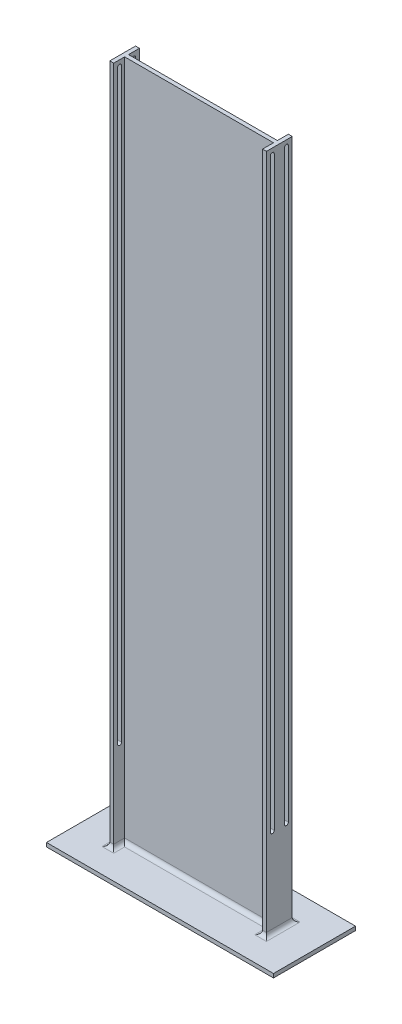
from build123d import *

# Parameters (mm, degrees)
WALL_EXTRUDE_DEPTH           = 190.5
RIGHT_GUIDE_EXTRUDE_DEPTH    = 10
SKETCH3_W                    = 581
SKETCH3_H                    = 210
BOTTOM_FOOT_COMPLETION_DEPTH = 10
SKETCH4_W                    = 381
SKETCH4_H                    = 10
PLATFORM_STOPPER_DEPTH       = 28
STRUCTURAL_FILLETS_R         = 10


with BuildPart() as part:
    # Sketch1 → Wall extrude (new, symmetric)
    with BuildSketch(Plane(origin=(0, 0, 0), x_dir=(0, 0, -1), z_dir=(1, 0, 0))):
        Polygon((0, 0), (-100, 0), (-100, -10), (10, -10), (110, -10), (110, 0), (10, 0), (10, 1741.5), (0, 1741.5), align=None)
    extrude(amount=WALL_EXTRUDE_DEPTH, both=True)

    # Sketch2 → Right guide extrude (add)
    with BuildSketch(Plane(origin=(190.5, 0, 0), x_dir=(0, 0, -1), z_dir=(1, 0, 0))):
        Polygon((0, 1741.5), (38, 1741.5), (38, -10), (0, -10), (-28, -10), (-28, 1741.5), align=None)
        with BuildLine():
            Line((18, 226.5), (18, 1726.5))
            ThreePointArc((18, 1726.5), (23, 1731.5), (28, 1726.5))
            Line((28, 1726.5), (28, 226.5))
            ThreePointArc((28, 226.5), (23, 221.5), (18, 226.5))
        make_face(mode=Mode.SUBTRACT)
        with BuildLine():
            Line((-18, 1726.5), (-18, 226.5))
            ThreePointArc((-18, 226.5), (-13, 221.5), (-8, 226.5))
            Line((-8, 226.5), (-8, 1726.5))
            ThreePointArc((-8, 1726.5), (-13, 1731.5), (-18, 1726.5))
        make_face(mode=Mode.SUBTRACT)
    right_guide_extrude = extrude(amount=RIGHT_GUIDE_EXTRUDE_DEPTH)

    # Left guide extrude: Right guide extrude across plane
    add(right_guide_extrude.mirror(Plane(origin=(0, 0, 0), x_dir=(0, 0, 1), z_dir=(1, 0, 0))))

    # Sketch3 → Bottom foot completion (add)
    with BuildSketch(Plane.XZ.offset(10)):
        with Locations((0, -5)):
            Rectangle(SKETCH3_W, SKETCH3_H)
    extrude(amount=-BOTTOM_FOOT_COMPLETION_DEPTH)

    # Sketch4 → Platform stopper (add)
    with BuildSketch(Plane(origin=(0, 0, -10), x_dir=(-1, 0, 0), z_dir=(0, 0, -1))):
        with Locations((0, 131.5)):
            Rectangle(SKETCH4_W, SKETCH4_H)
    extrude(amount=PLATFORM_STOPPER_DEPTH)

    # Structural fillets
    structural_fillets_edges = [part.edges().sort_by_distance(p)[0] for p in [
        (195.5, 0, 28),
        (195.5, 0, -38),
        (200.5, 0, -5),
        (-195.5, 0, -38),
        (-200.5, 0, -5),
        (-195.5, 0, 28),
        (-190.5, 0, 14),
        (-190.5, 126.5, -24),
        (190.5, 126.5, -24),
        (0, 126.5, -10),
        (0, 0, -10),
        (0, 0, 0),
        (190.5, 0, -24),
        (-190.5, 0, -24),
        (190.5, 0, 14),
    ]]
    fillet(structural_fillets_edges, radius=STRUCTURAL_FILLETS_R)


solid = part.part
